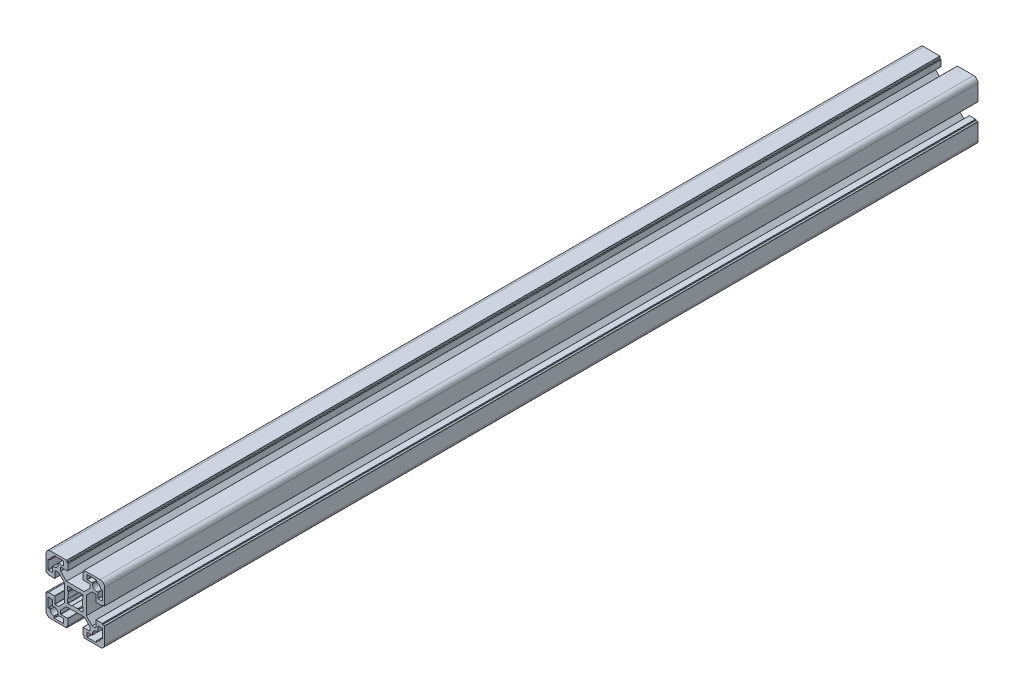
from build123d import *

# Parameters (mm, degrees)
EXTRUDE_1_DEPTH = 298


with BuildPart() as part:
    # Model → Бобышка-Вытянуть1 (new, symmetric)
    with BuildSketch(Plane.XY):
        with BuildLine():
            Line((7.5, 6.0858), (11.4642, 10.05))
            Line((11.4642, 10.05), (13.8, 10.05))
            ThreePointArc((13.8, 10.05), (13.941421356, 9.991421356), (14, 9.85))
            Line((14, 9.85), (14, 5.35))
            ThreePointArc((14, 5.35), (14.058578644, 5.208578644), (14.2, 5.15))
            Line((14.2, 5.15), (18.3, 5.15))
            ThreePointArc((18.3, 5.15), (18.441421356, 5.208578644), (18.5, 5.35))
            Line((18.5, 5.35), (18.5, 5.6))
            ThreePointArc((18.5, 5.6), (18.558578644, 5.741421356), (18.7, 5.8))
            Line((18.7, 5.8), (19.8, 5.8))
            ThreePointArc((19.8, 5.8), (19.941421356, 5.858578644), (20, 6))
            Line((20, 6), (20, 17))
            ThreePointArc((20, 17), (19.121320344, 19.121320344), (17, 20))
            Line((17, 20), (6, 20))
            ThreePointArc((6, 20), (5.858578644, 19.941421356), (5.8, 19.8))
            Line((5.8, 19.8), (5.8, 18.7))
            ThreePointArc((5.8, 18.7), (5.741421356, 18.558578644), (5.6, 18.5))
            Line((5.6, 18.5), (5.35, 18.5))
            ThreePointArc((5.35, 18.5), (5.208578644, 18.441421356), (5.15, 18.3))
            Line((5.15, 18.3), (5.15, 14.2))
            ThreePointArc((5.15, 14.2), (5.208578644, 14.058578644), (5.35, 14))
            Line((5.35, 14), (9.85, 14))
            ThreePointArc((9.85, 14), (9.991421356, 13.941421356), (10.05, 13.8))
            Line((10.05, 13.8), (10.05, 11.4642))
            Line((10.05, 11.4642), (6.0858, 7.5))
            Line((6.0858, 7.5), (-6.0858, 7.5))
            Line((-6.0858, 7.5), (-10.05, 11.4642))
            Line((-10.05, 11.4642), (-10.05, 13.8))
            ThreePointArc((-10.05, 13.8), (-9.991421356, 13.941421356), (-9.85, 14))
            Line((-9.85, 14), (-5.35, 14))
            ThreePointArc((-5.35, 14), (-5.208578644, 14.058578644), (-5.15, 14.2))
            Line((-5.15, 14.2), (-5.15, 18.3))
            ThreePointArc((-5.15, 18.3), (-5.208578644, 18.441421356), (-5.35, 18.5))
            Line((-5.35, 18.5), (-5.6, 18.5))
            ThreePointArc((-5.6, 18.5), (-5.741421356, 18.558578644), (-5.8, 18.7))
            Line((-5.8, 18.7), (-5.8, 19.8))
            ThreePointArc((-5.8, 19.8), (-5.858578644, 19.941421356), (-6, 20))
            Line((-6, 20), (-17, 20))
            ThreePointArc((-17, 20), (-19.121320344, 19.121320344), (-20, 17))
            Line((-20, 17), (-20, 6))
            ThreePointArc((-20, 6), (-19.941421356, 5.858578644), (-19.8, 5.8))
            Line((-19.8, 5.8), (-18.7, 5.8))
            ThreePointArc((-18.7, 5.8), (-18.558578644, 5.741421356), (-18.5, 5.6))
            Line((-18.5, 5.6), (-18.5, 5.35))
            ThreePointArc((-18.5, 5.35), (-18.441421356, 5.208578644), (-18.3, 5.15))
            Line((-18.3, 5.15), (-14.2, 5.15))
            ThreePointArc((-14.2, 5.15), (-14.058578644, 5.208578644), (-14, 5.35))
            Line((-14, 5.35), (-14, 9.85))
            ThreePointArc((-14, 9.85), (-13.941421356, 9.991421356), (-13.8, 10.05))
            Line((-13.8, 10.05), (-11.4642, 10.05))
            Line((-11.4642, 10.05), (-7.5, 6.0858))
            Line((-7.5, 6.0858), (-7.5, -6.0858))
            Line((-7.5, -6.0858), (-11.4642, -10.05))
            Line((-11.4642, -10.05), (-13.8, -10.05))
            ThreePointArc((-13.8, -10.05), (-13.941421356, -9.991421356), (-14, -9.85))
            Line((-14, -9.85), (-14, -5.35))
            ThreePointArc((-14, -5.35), (-14.058578644, -5.208578644), (-14.2, -5.15))
            Line((-14.2, -5.15), (-18.3, -5.15))
            ThreePointArc((-18.3, -5.15), (-18.441421356, -5.208578644), (-18.5, -5.35))
            Line((-18.5, -5.35), (-18.5, -5.6))
            ThreePointArc((-18.5, -5.6), (-18.558578644, -5.741421356), (-18.7, -5.8))
            Line((-18.7, -5.8), (-19.8, -5.8))
            ThreePointArc((-19.8, -5.8), (-19.941421356, -5.858578644), (-20, -6))
            Line((-20, -6), (-20, -17))
            ThreePointArc((-20, -17), (-19.121320344, -19.121320344), (-17, -20))
            Line((-17, -20), (-6, -20))
            ThreePointArc((-6, -20), (-5.858578644, -19.941421356), (-5.8, -19.8))
            Line((-5.8, -19.8), (-5.8, -18.7))
            ThreePointArc((-5.8, -18.7), (-5.741421356, -18.558578644), (-5.6, -18.5))
            Line((-5.6, -18.5), (-5.35, -18.5))
            ThreePointArc((-5.35, -18.5), (-5.208578644, -18.441421356), (-5.15, -18.3))
            Line((-5.15, -18.3), (-5.15, -14.2))
            ThreePointArc((-5.15, -14.2), (-5.208578644, -14.058578644), (-5.35, -14))
            Line((-5.35, -14), (-9.85, -14))
            ThreePointArc((-9.85, -14), (-9.991421356, -13.941421356), (-10.05, -13.8))
            Line((-10.05, -13.8), (-10.05, -11.4642))
            Line((-10.05, -11.4642), (-6.0858, -7.5))
            Line((-6.0858, -7.5), (6.0858, -7.5))
            Line((6.0858, -7.5), (10.05, -11.4642))
            Line((10.05, -11.4642), (10.05, -13.8))
            ThreePointArc((10.05, -13.8), (9.991421356, -13.941421356), (9.85, -14))
            Line((9.85, -14), (5.35, -14))
            ThreePointArc((5.35, -14), (5.208578644, -14.058578644), (5.15, -14.2))
            Line((5.15, -14.2), (5.15, -18.3))
            ThreePointArc((5.15, -18.3), (5.208578644, -18.441421356), (5.35, -18.5))
            Line((5.35, -18.5), (5.6, -18.5))
            ThreePointArc((5.6, -18.5), (5.741421356, -18.558578644), (5.8, -18.7))
            Line((5.8, -18.7), (5.8, -19.8))
            ThreePointArc((5.8, -19.8), (5.858578644, -19.941421356), (6, -20))
            Line((6, -20), (17, -20))
            ThreePointArc((17, -20), (19.121320344, -19.121320344), (20, -17))
            Line((20, -17), (20, -6))
            ThreePointArc((20, -6), (19.941421356, -5.858578644), (19.8, -5.8))
            Line((19.8, -5.8), (18.7, -5.8))
            ThreePointArc((18.7, -5.8), (18.558578644, -5.741421356), (18.5, -5.6))
            Line((18.5, -5.6), (18.5, -5.35))
            ThreePointArc((18.5, -5.35), (18.441421356, -5.208578644), (18.3, -5.15))
            Line((18.3, -5.15), (14.2, -5.15))
            ThreePointArc((14.2, -5.15), (14.058578644, -5.208578644), (14, -5.35))
            Line((14, -5.35), (14, -9.85))
            ThreePointArc((14, -9.85), (13.941421356, -9.991421356), (13.8, -10.05))
            Line((13.8, -10.05), (11.4642, -10.05))
            Line((11.4642, -10.05), (7.5, -6.0858))
            Line((7.5, -6.0858), (7.5, 6.0858))
        make_face()
        with BuildLine():
            Line((15.7, -8), (18.3, -8))
            ThreePointArc((18.3, -8), (18.441421356, -8.058578644), (18.5, -8.2))
            Line((18.5, -8.2), (18.5, -14.3))
            ThreePointArc((18.5, -14.3), (18.441421356, -14.441421356), (18.3, -14.5))
            Line((18.3, -14.5), (17.443212531, -14.5))
            ThreePointArc((17.443212531, -14.5), (17.306669249, -14.55386331), (17.243672698, -14.686440678))
            ThreePointArc((17.243672698, -14.686440678), (16.444543648, -16.444543648), (14.686440678, -17.243672698))
            ThreePointArc((14.686440678, -17.243672698), (14.55386331, -17.306669249), (14.5, -17.443212531))
            Line((14.5, -17.443212531), (14.5, -18.3))
            ThreePointArc((14.5, -18.3), (14.441421356, -18.441421356), (14.3, -18.5))
            Line((14.3, -18.5), (8.2, -18.5))
            ThreePointArc((8.2, -18.5), (8.058578644, -18.441421356), (8, -18.3))
            Line((8, -18.3), (8, -15.7))
            ThreePointArc((8, -15.7), (8.058578644, -15.558578644), (8.2, -15.5))
            Line((8.2, -15.5), (11.55, -15.5))
            ThreePointArc((11.55, -15.5), (11.691421356, -15.441421356), (11.75, -15.3))
            Line((11.75, -15.3), (11.75, -14.5))
            ThreePointArc((11.75, -14.5), (12.555456352, -12.555456352), (14.5, -11.75))
            Line((14.5, -11.75), (15.3, -11.75))
            ThreePointArc((15.3, -11.75), (15.441421356, -11.691421356), (15.5, -11.55))
            Line((15.5, -11.55), (15.5, -8.2))
            ThreePointArc((15.5, -8.2), (15.558578644, -8.058578644), (15.7, -8))
        make_face(mode=Mode.SUBTRACT)
        with BuildLine():
            Line((-18.3, -8), (-15.7, -8))
            ThreePointArc((-15.7, -8), (-15.558578644, -8.058578644), (-15.5, -8.2))
            Line((-15.5, -8.2), (-15.5, -11.55))
            ThreePointArc((-15.5, -11.55), (-15.441421356, -11.691421356), (-15.3, -11.75))
            Line((-15.3, -11.75), (-14.5, -11.75))
            ThreePointArc((-14.5, -11.75), (-12.555456352, -12.555456352), (-11.75, -14.5))
            Line((-11.75, -14.5), (-11.75, -15.3))
            ThreePointArc((-11.75, -15.3), (-11.691421356, -15.441421356), (-11.55, -15.5))
            Line((-11.55, -15.5), (-8.2, -15.5))
            ThreePointArc((-8.2, -15.5), (-8.058578644, -15.558578644), (-8, -15.7))
            Line((-8, -15.7), (-8, -18.3))
            ThreePointArc((-8, -18.3), (-8.058578644, -18.441421356), (-8.2, -18.5))
            Line((-8.2, -18.5), (-14.3, -18.5))
            ThreePointArc((-14.3, -18.5), (-14.441421356, -18.441421356), (-14.5, -18.3))
            Line((-14.5, -18.3), (-14.5, -17.443212531))
            ThreePointArc((-14.5, -17.443212531), (-14.55386331, -17.306669249), (-14.686440678, -17.243672698))
            ThreePointArc((-14.686440678, -17.243672698), (-16.444543648, -16.444543648), (-17.243672698, -14.686440678))
            ThreePointArc((-17.243672698, -14.686440678), (-17.306669249, -14.55386331), (-17.443212531, -14.5))
            Line((-17.443212531, -14.5), (-18.3, -14.5))
            ThreePointArc((-18.3, -14.5), (-18.441421356, -14.441421356), (-18.5, -14.3))
            Line((-18.5, -14.3), (-18.5, -8.2))
            ThreePointArc((-18.5, -8.2), (-18.441421356, -8.058578644), (-18.3, -8))
        make_face(mode=Mode.SUBTRACT)
        with BuildLine():
            Line((-5, 5.2), (-2.261, 5.2))
            Line((-2.261, 5.2), (-2.071925246, 4.765191727))
            ThreePointArc((-2.071925246, 4.765191727), (-1.965379386, 4.66030673), (-1.815880292, 4.658602662))
            ThreePointArc((-1.815880292, 4.658602662), (0, 5), (1.815880292, 4.658602662))
            ThreePointArc((1.815880292, 4.658602662), (1.965379386, 4.66030673), (2.071925246, 4.765191727))
            Line((2.071925246, 4.765191727), (2.261, 5.2))
            Line((2.261, 5.2), (5, 5.2))
            ThreePointArc((5, 5.2), (5.141421356, 5.141421356), (5.2, 5))
            Line((5.2, 5), (5.2, 2.261))
            Line((5.2, 2.261), (4.765191727, 2.071925246))
            ThreePointArc((4.765191727, 2.071925246), (4.66030673, 1.965379386), (4.658602662, 1.815880292))
            ThreePointArc((4.658602662, 1.815880292), (5, 0), (4.658602662, -1.815880292))
            ThreePointArc((4.658602662, -1.815880292), (4.66030673, -1.965379386), (4.765191727, -2.071925246))
            Line((4.765191727, -2.071925246), (5.2, -2.261))
            Line((5.2, -2.261), (5.2, -5))
            ThreePointArc((5.2, -5), (5.141421356, -5.141421356), (5, -5.2))
            Line((5, -5.2), (2.261, -5.2))
            Line((2.261, -5.2), (2.071925246, -4.765191727))
            ThreePointArc((2.071925246, -4.765191727), (1.965379386, -4.66030673), (1.815880292, -4.658602662))
            ThreePointArc((1.815880292, -4.658602662), (0, -5), (-1.815880292, -4.658602662))
            ThreePointArc((-1.815880292, -4.658602662), (-1.965379386, -4.66030673), (-2.071925246, -4.765191727))
            Line((-2.071925246, -4.765191727), (-2.261, -5.2))
            Line((-2.261, -5.2), (-5, -5.2))
            ThreePointArc((-5, -5.2), (-5.141421356, -5.141421356), (-5.2, -5))
            Line((-5.2, -5), (-5.2, -2.261))
            Line((-5.2, -2.261), (-4.765191727, -2.071925246))
            ThreePointArc((-4.765191727, -2.071925246), (-4.66030673, -1.965379386), (-4.658602662, -1.815880292))
            ThreePointArc((-4.658602662, -1.815880292), (-5, 0), (-4.658602662, 1.815880292))
            ThreePointArc((-4.658602662, 1.815880292), (-4.66030673, 1.965379386), (-4.765191727, 2.071925246))
            Line((-4.765191727, 2.071925246), (-5.2, 2.261))
            Line((-5.2, 2.261), (-5.2, 5))
            ThreePointArc((-5.2, 5), (-5.141421356, 5.141421356), (-5, 5.2))
        make_face(mode=Mode.SUBTRACT)
        with BuildLine():
            Line((11.55, 15.5), (8.2, 15.5))
            ThreePointArc((8.2, 15.5), (8.058578644, 15.558578644), (8, 15.7))
            Line((8, 15.7), (8, 18.3))
            ThreePointArc((8, 18.3), (8.058578644, 18.441421356), (8.2, 18.5))
            Line((8.2, 18.5), (14.3, 18.5))
            ThreePointArc((14.3, 18.5), (14.441421356, 18.441421356), (14.5, 18.3))
            Line((14.5, 18.3), (14.5, 17.443212531))
            ThreePointArc((14.5, 17.443212531), (14.55386331, 17.306669249), (14.686440678, 17.243672698))
            ThreePointArc((14.686440678, 17.243672698), (16.444543648, 16.444543648), (17.243672698, 14.686440678))
            ThreePointArc((17.243672698, 14.686440678), (17.306669249, 14.55386331), (17.443212531, 14.5))
            Line((17.443212531, 14.5), (18.3, 14.5))
            ThreePointArc((18.3, 14.5), (18.441421356, 14.441421356), (18.5, 14.3))
            Line((18.5, 14.3), (18.5, 8.2))
            ThreePointArc((18.5, 8.2), (18.441421356, 8.058578644), (18.3, 8))
            Line((18.3, 8), (15.7, 8))
            ThreePointArc((15.7, 8), (15.558578644, 8.058578644), (15.5, 8.2))
            Line((15.5, 8.2), (15.5, 11.55))
            ThreePointArc((15.5, 11.55), (15.441421356, 11.691421356), (15.3, 11.75))
            Line((15.3, 11.75), (14.5, 11.75))
            ThreePointArc((14.5, 11.75), (12.555456352, 12.555456352), (11.75, 14.5))
            Line((11.75, 14.5), (11.75, 15.3))
            ThreePointArc((11.75, 15.3), (11.691421356, 15.441421356), (11.55, 15.5))
        make_face(mode=Mode.SUBTRACT)
        with BuildLine():
            Line((-14.5, 11.75), (-15.3, 11.75))
            ThreePointArc((-15.3, 11.75), (-15.441421356, 11.691421356), (-15.5, 11.55))
            Line((-15.5, 11.55), (-15.5, 8.2))
            ThreePointArc((-15.5, 8.2), (-15.558578644, 8.058578644), (-15.7, 8))
            Line((-15.7, 8), (-18.3, 8))
            ThreePointArc((-18.3, 8), (-18.441421356, 8.058578644), (-18.5, 8.2))
            Line((-18.5, 8.2), (-18.5, 14.3))
            ThreePointArc((-18.5, 14.3), (-18.441421356, 14.441421356), (-18.3, 14.5))
            Line((-18.3, 14.5), (-17.443212531, 14.5))
            ThreePointArc((-17.443212531, 14.5), (-17.306669249, 14.55386331), (-17.243672698, 14.686440678))
            ThreePointArc((-17.243672698, 14.686440678), (-16.444543648, 16.444543648), (-14.686440678, 17.243672698))
            ThreePointArc((-14.686440678, 17.243672698), (-14.55386331, 17.306669249), (-14.5, 17.443212531))
            Line((-14.5, 17.443212531), (-14.5, 18.3))
            ThreePointArc((-14.5, 18.3), (-14.441421356, 18.441421356), (-14.3, 18.5))
            Line((-14.3, 18.5), (-8.2, 18.5))
            ThreePointArc((-8.2, 18.5), (-8.058578644, 18.441421356), (-8, 18.3))
            Line((-8, 18.3), (-8, 15.7))
            ThreePointArc((-8, 15.7), (-8.058578644, 15.558578644), (-8.2, 15.5))
            Line((-8.2, 15.5), (-11.55, 15.5))
            ThreePointArc((-11.55, 15.5), (-11.691421356, 15.441421356), (-11.75, 15.3))
            Line((-11.75, 15.3), (-11.75, 14.5))
            ThreePointArc((-11.75, 14.5), (-12.555456352, 12.555456352), (-14.5, 11.75))
        make_face(mode=Mode.SUBTRACT)
    extrude(amount=EXTRUDE_1_DEPTH, both=True)


solid = part.part
